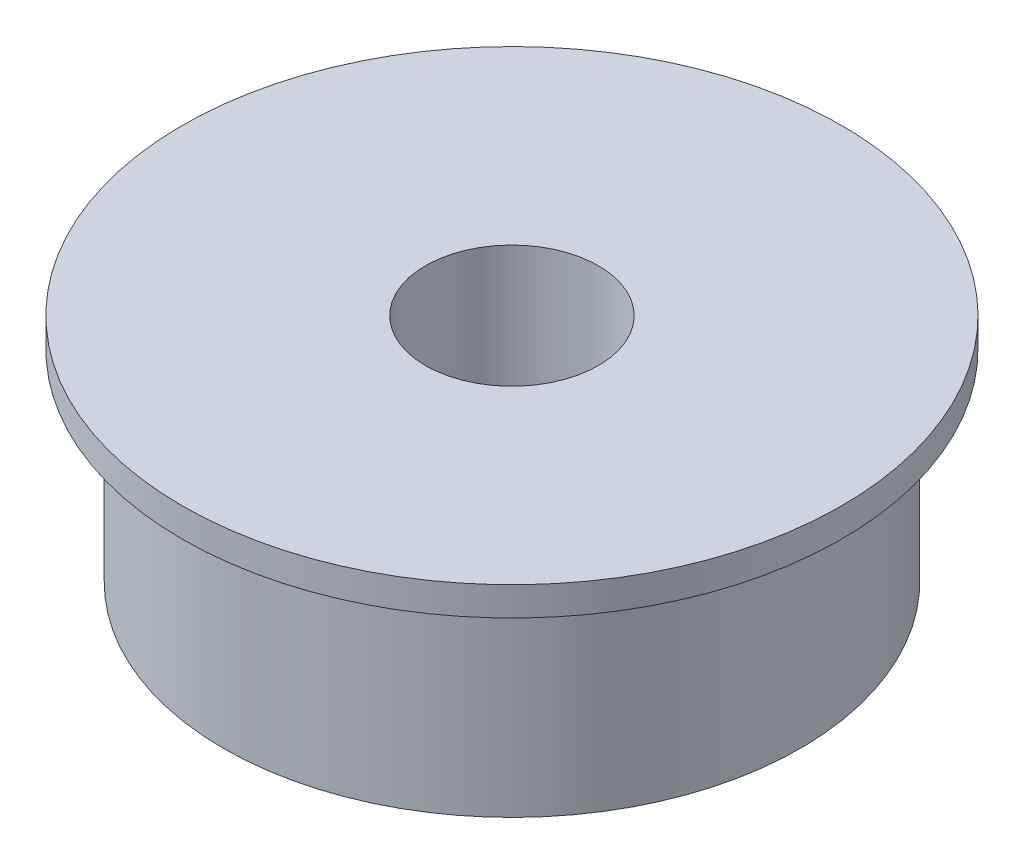
from build123d import *

# Parameters (mm, degrees)
SKETCH1_R           = 5
BOSS_EXTRUDE1_DEPTH = 3.499993
SKETCH2_R           = 5.715
BOSS_EXTRUDE2_DEPTH = 0.500507
CUT_EXTRUDE1_REACH  = 11.018
SKETCH3_R           = 1.5


with BuildPart() as part:
    # Sketch1 → Boss-Extrude1 (new body)
    with BuildSketch(Plane(origin=(0, 0, 0), x_dir=(1, 0, 0), z_dir=(0, 1, 0))):
        with Locations(Location((0, 0, 0), (0, 0, 270))):
            Circle(SKETCH1_R)
    extrude(amount=BOSS_EXTRUDE1_DEPTH)

    # Sketch2 → Boss-Extrude2 (add)
    with BuildSketch(Plane(origin=(0, 3.499993, 0), x_dir=(1, 0, 0), z_dir=(0, 1, 0))):
        with Locations(Location((0, 0, 0), (0, 0, 270))):
            Circle(SKETCH2_R)
    extrude(amount=BOSS_EXTRUDE2_DEPTH)

    # Sketch3 → Cut-Extrude1 (cut, up to next)
    with BuildSketch(Plane(origin=(0, 4.0005, 0), x_dir=(1, 0, 0), z_dir=(0, 1, 0)), mode=Mode.PRIVATE) as cut_extrude1_sk1:
        with Locations(Location((0, 0, 0), (0, 0, 270))):
            Circle(SKETCH3_R)
    cut_extrude1_tool1 = extrude(cut_extrude1_sk1.sketch, amount=-CUT_EXTRUDE1_REACH, mode=Mode.PRIVATE) & part.part
    add(cut_extrude1_tool1.solids().sort_by_distance((0, 4.0005, 0))[0], mode=Mode.SUBTRACT)


solid = part.part
